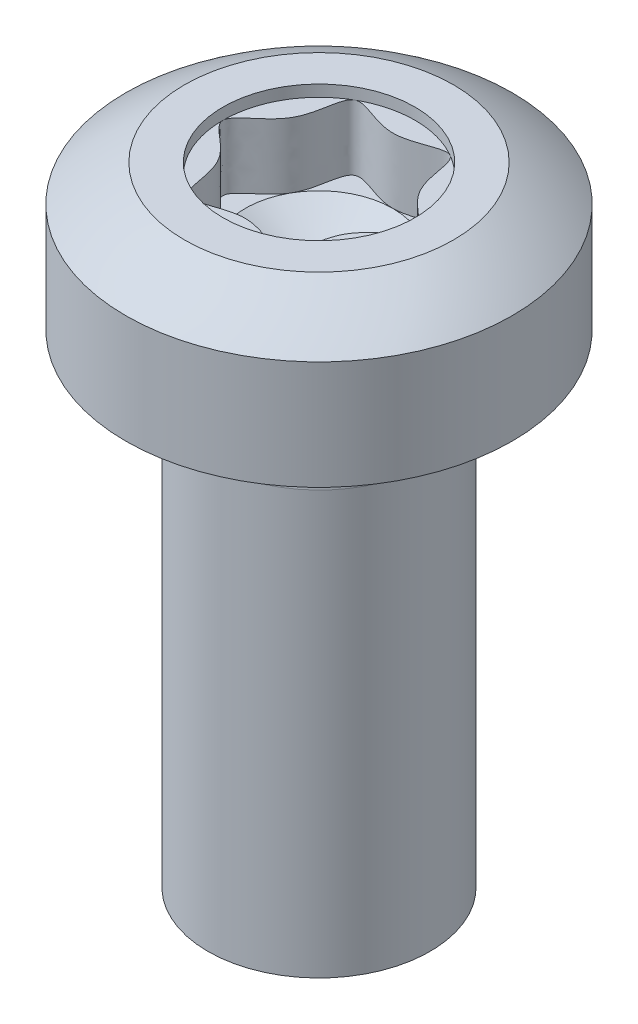
from build123d import *

# Parameters (mm, degrees)
RECESS_CUT_EXTRUDE1_DEPTH = 3.18
SKETCH7_R                 = 3.975
RECESS_CUT_EXTRUDE2_DEPTH = 0.477


with BuildPart() as part:
    # Sketch1 → BODY (revolve)
    with BuildSketch(Plane.XY, mode=Mode.PRIVATE) as body_sk:
        Polygon((0, 0), (4.6, 0), (4.6, 20), (8, 20), (8, 26), (0, 26), align=None)
    revolve(body_sk.sketch.rotate(Axis((0, 0, 0), (0, 1, 0)), 90), axis=Axis((0, 0, 0), (0, 1, 0)))

    # Sketch2 → HEAD-CUT (revolve, cut)
    with BuildSketch(Plane.XY, mode=Mode.PRIVATE) as head_cut_sk:
        with BuildLine():
            ThreePointArc((13, 14.253049234), (9.192388155, 23.445437389), (0, 27.253049234))
            Line((0, 27.253049234), (0, 27.735210804))
            Line((0, 27.735210804), (13, 27.735210804))
            Line((13, 27.735210804), (13, 14.253049234))
        make_face()
    revolve(head_cut_sk.sketch.rotate(Axis((0, 0, 0), (0, 1, 0)), 90), axis=Axis((0, 0, 0), (0, 1, 0)), mode=Mode.SUBTRACT)

    # Sketch4 → GAP (revolve, cut)
    with BuildSketch(Plane.XY, mode=Mode.PRIVATE) as gap_sk:
        with BuildLine():
            Line((-4.6, 17.5), (-4.379966632, 19.6))
            ThreePointArc((-4.379966632, 19.6), (-4.427314852, 19.834472883), (-4.6, 20))
            Line((-4.6, 20), (-4.6, 17.5))
        make_face()
    revolve(gap_sk.sketch.rotate(Axis((0, 0, 0), (0, 1, 0)), 270), axis=Axis((0, 0, 0), (0, 1, 0)), mode=Mode.SUBTRACT)

    # Sketch5 → Recess-Cut-Extrude1 (cut)
    with BuildSketch(Plane(origin=(0, 26, 0), x_dir=(-1, 0, 0), z_dir=(0, 1, 0))):
        with BuildLine():
            add(Edge.make_bspline(
                [(0, 3.057692308), (-0.815686275, 3.057692308), (-2.447058824, 4.238430212), (-2.136764705, 1.233661678), (-4.894117647, 0), (-2.136764705, -1.233661678), (-2.447058824, -4.238430212), (0, -2.467323356), (2.447058824, -4.238430212), (2.136764705, -1.233661678), (4.894117647, 0), (2.136764705, 1.233661678), (2.447058824, 4.238430212), (0.815686275, 3.057692308), (0, 3.057692308)],
                knots=[0, 0, 0, 0, 0.083333333, 0.166666667, 0.25, 0.333333333, 0.416666667, 0.5, 0.583333333, 0.666666667, 0.75, 0.833333333, 0.916666667, 1, 1, 1, 1], degree=3))
        make_face()
    extrude(amount=-RECESS_CUT_EXTRUDE1_DEPTH, mode=Mode.SUBTRACT)

    # Sketch3 → DRILL-CUT (revolve, cut)
    with BuildSketch(Plane.XY, mode=Mode.PRIVATE) as drill_cut_sk:
        Polygon((0, 21.054640523), (3.057692308, 22.82), (0, 22.82), align=None)
    revolve(drill_cut_sk.sketch.rotate(Axis((0, 0, 0), (0, 1, 0)), 270), axis=Axis((0, 0, 0), (0, 1, 0)), mode=Mode.SUBTRACT)

    # Sketch7 → Recess-Cut-Extrude2 (cut)
    with BuildSketch(Plane(origin=(0, 26, 0), x_dir=(-1, 0, 0), z_dir=(0, 1, 0))):
        with Locations(Location((0, 0, 0), (0, 0, 90))):
            Circle(SKETCH7_R)
    extrude(amount=-RECESS_CUT_EXTRUDE2_DEPTH, mode=Mode.SUBTRACT)


solid = part.part
